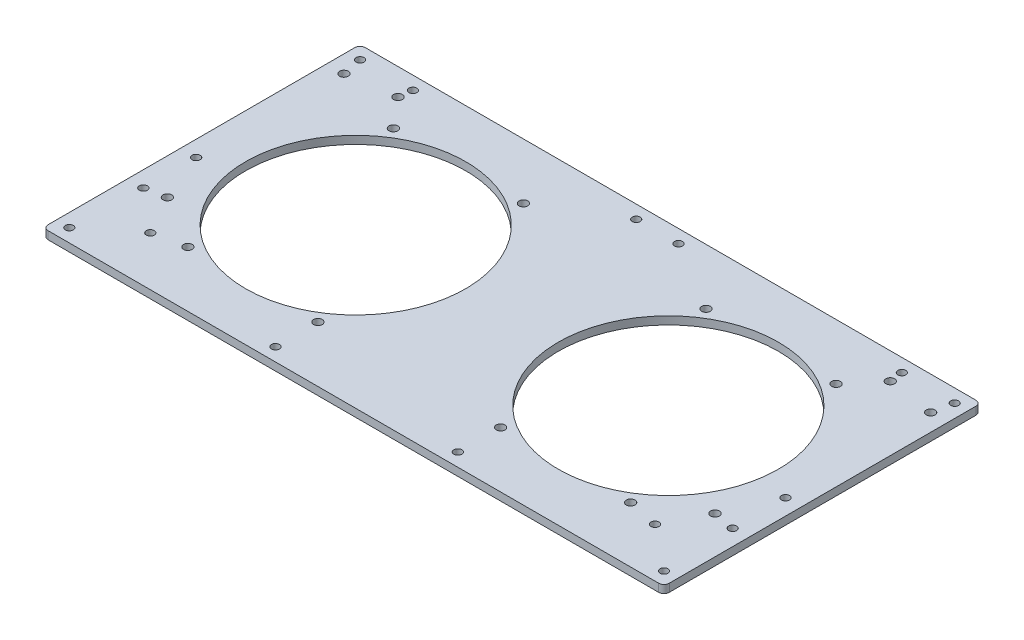
from build123d import *

# Parameters (mm, degrees)
SKETCH_1_W          = 235
SKETCH_1_H          = 120
SKETCH_1_R          = 41.65
EXTRUDE_1_DEPTH     = 3
SKETCH_2_R          = 1.65
CUT_EXTRUDE_1_DEPTH = 3
SKETCH_3_R          = 1.5
SKETCH_3_R_2        = 1.65
CUT_EXTRUDE_2_DEPTH = 3
SKETCH_4_R          = 1.5
CUT_EXTRUDE_3_DEPTH = 3
SKETCH_5_R          = 1.5
CUT_EXTRUDE_4_DEPTH = 3
FILLET_1_R          = 2
SKETCH_6_R          = 1.65
CUT_EXTRUDE_5_DEPTH = 10


with BuildPart() as part:
    # 草图1 → 凸台-拉伸1 (new body)
    with BuildSketch(Plane(origin=(0, 0, 0), x_dir=(1, 0, 0), z_dir=(0, 1, 0))):
        Rectangle(SKETCH_1_W, SKETCH_1_H)
        with Locations(Location((-59.15, 0, 0), (0, 0, 270))):
            Circle(SKETCH_1_R, mode=Mode.SUBTRACT)
        with Locations(Location((59.15, 0, 0), (0, 0, 90))):
            Circle(SKETCH_1_R, mode=Mode.SUBTRACT)
    extrude(amount=EXTRUDE_1_DEPTH)

    # 草图2 → 切除-拉伸1 (cut)
    with BuildSketch(Plane(origin=(0, 3, 0), x_dir=(1, 0, 0), z_dir=(0, 1, 0))):
        with Locations(Location((-83.75, -38.869525338, 0), (0, 0, 270))):
            Circle(SKETCH_2_R)
        with Locations(Location((-83.75, 38.869525338, 0), (0, 0, 270))):
            Circle(SKETCH_2_R)
        with Locations(Location((-34.55, 38.869525338, 0), (0, 0, 90))):
            Circle(SKETCH_2_R)
        with Locations(Location((-34.55, -38.869525338, 0), (0, 0, 90))):
            Circle(SKETCH_2_R)
        with Locations(Location((34.55, -38.869525338, 0), (0, 0, 270))):
            Circle(SKETCH_2_R)
        with Locations(Location((83.75, -38.869525338, 0), (0, 0, 90))):
            Circle(SKETCH_2_R)
        with Locations(Location((34.55, 38.869525338, 0), (0, 0, 270))):
            Circle(SKETCH_2_R)
        with Locations(Location((83.75, 38.869525338, 0), (0, 0, 90))):
            Circle(SKETCH_2_R)
    extrude(amount=-CUT_EXTRUDE_1_DEPTH, mode=Mode.SUBTRACT)

    # 草图3 → 切除-拉伸2 (cut)
    with BuildSketch(Plane(origin=(0, 3, 0), x_dir=(1, 0, 0), z_dir=(0, 1, 0))):
        with Locations(Location((-111.5, -28, 0), (0, 0, 270))):
            Circle(SKETCH_3_R)
        with Locations(Location((-111.5, -8, 0), (0, 0, 270))):
            Circle(SKETCH_3_R)
        with Locations(Location((111.5, -8, 0), (0, 0, 90))):
            Circle(SKETCH_3_R)
        with Locations(Location((111.5, -28, 0), (0, 0, 90))):
            Circle(SKETCH_3_R)
        with Locations(Location((-112.5, 55, 0), (0, 0, 270))):
            Circle(SKETCH_3_R)
        with Locations(Location((-92.5, 55, 0), (0, 0, 270))):
            Circle(SKETCH_3_R)
        with Locations(Location((92.5, 55, 0), (0, 0, 90))):
            Circle(SKETCH_3_R)
        with Locations(Location((112.5, 55, 0), (0, 0, 90))):
            Circle(SKETCH_3_R)
        with Locations(Location((103.310016868, -26.5, 0), (0, 0, 270))):
            Circle(SKETCH_3_R_2)
        with Locations(Location((-93.135083269, 50, 0), (0, 0, 270))):
            Circle(SKETCH_3_R_2)
        with Locations(Location((-111, 47.400657923, 0), (0, 0, 270))):
            Circle(SKETCH_3_R_2)
        with Locations(Location((93.135083269, 50, 0), (0, 0, 270))):
            Circle(SKETCH_3_R_2)
        with Locations(Location((111, 47.400657923, 0), (0, 0, 270))):
            Circle(SKETCH_3_R_2)
        with Locations(Location((-95.485573862, -41.374781037, 0), (0, 0, 270))):
            Circle(SKETCH_3_R)
        with Locations(Location((95.485573862, -41.374781037, 0), (0, 0, 270))):
            Circle(SKETCH_3_R)
    extrude(amount=-CUT_EXTRUDE_2_DEPTH, mode=Mode.SUBTRACT)

    # 草图4 → 切除-拉伸3 (cut)
    with BuildSketch(Plane(origin=(0, 3, 0), x_dir=(1, 0, 0), z_dir=(0, 1, 0))):
        with Locations(Location((-112.5, -55, 0), (0, 0, 270))):
            Circle(SKETCH_4_R)
        with Locations(Location((-112.5, 55, 0), (0, 0, 270))):
            Circle(SKETCH_4_R)
        with Locations(Location((112.5, 55, 0), (0, 0, 90))):
            Circle(SKETCH_4_R)
        with Locations(Location((112.5, -55, 0), (0, 0, 270))):
            Circle(SKETCH_4_R)
        with Locations(Location((-34.5, -55, 0), (0, 0, 270))):
            Circle(SKETCH_4_R)
        with Locations(Location((34.5, -55, 0), (0, 0, 270))):
            Circle(SKETCH_4_R)
    extrude(amount=-CUT_EXTRUDE_3_DEPTH, mode=Mode.SUBTRACT)

    # 草图5 → 切除-拉伸4 (cut)
    with BuildSketch(Plane(origin=(0, 3, 0), x_dir=(1, 0, 0), z_dir=(0, 1, 0))):
        with Locations(Location((-8, 55, 0), (0, 0, 270))):
            Circle(SKETCH_5_R)
        with Locations(Location((8, 55, 0), (0, 0, 270))):
            Circle(SKETCH_5_R)
    extrude(amount=-CUT_EXTRUDE_4_DEPTH, mode=Mode.SUBTRACT)

    # 圆角1
    fillet_1_edges = [part.edges().sort_by_distance(p)[0] for p in [
        (117.5, 1.5, 60),
        (-117.5, 1.5, 60),
        (-117.5, 1.5, -60),
        (117.5, 1.5, -60),
    ]]
    fillet(fillet_1_edges, radius=FILLET_1_R)

    # 草图6 → 切除-拉伸5 (cut)
    with BuildSketch(Plane(origin=(0, 3, 0), x_dir=(1, 0, 0), z_dir=(0, 1, 0))):
        with Locations(Location((-103.900657923, -26.5, 0), (0, 0, 270))):
            Circle(SKETCH_6_R)
    extrude(amount=-CUT_EXTRUDE_5_DEPTH, mode=Mode.SUBTRACT)


solid = part.part
